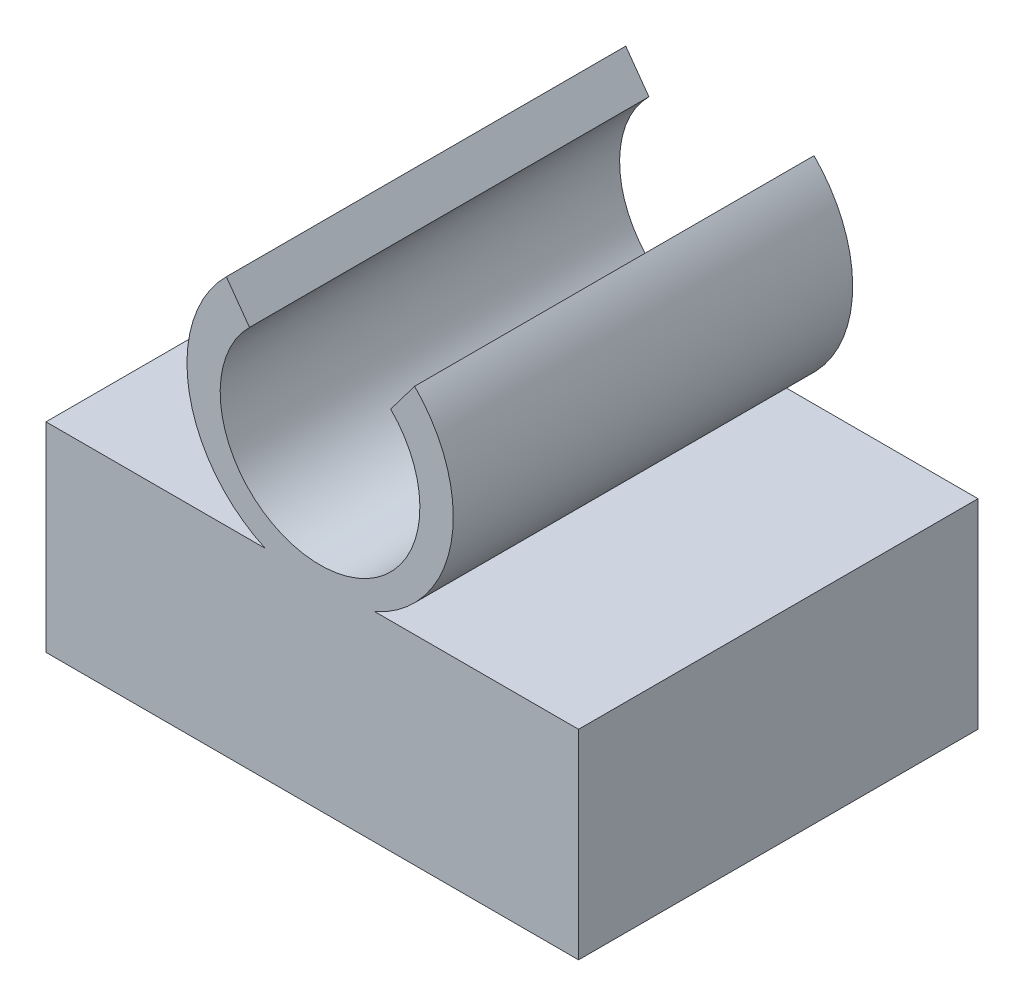
from build123d import *

# Parameters (mm, degrees)
SKETCH1_W           = 80
SKETCH1_H           = 60
BOSS_EXTRUDE2_DEPTH = 30
SKETCH2_W           = 72
SKETCH2_H           = 25
CUT_EXTRUDE1_DEPTH  = 55
BOSS_EXTRUDE3_DEPTH = 60


with BuildPart() as part:
    # Sketch1 → Boss-Extrude2 (new body)
    with BuildSketch(Plane(origin=(0, 0, 0), x_dir=(1, 0, 0), z_dir=(0, 1, 0))):
        with Locations((6.460176991, 17.057522124)):
            Rectangle(SKETCH1_W, SKETCH1_H)
    extrude(amount=BOSS_EXTRUDE2_DEPTH)

    # Sketch2 → Cut-Extrude1 (cut)
    with BuildSketch(Plane(origin=(0, 0, -47.057522124), x_dir=(-1, 0, 0), z_dir=(0, 0, -1))):
        with Locations((-6.207310929, 14.727365754)):
            Rectangle(SKETCH2_W, SKETCH2_H)
    extrude(amount=-CUT_EXTRUDE1_DEPTH, mode=Mode.SUBTRACT)


with BuildPart() as body_2:
    # Sketch3 → Boss-Extrude3 (new body)
    with BuildSketch(Plane(origin=(0, 0, -47.057522124), x_dir=(-1, 0, 0), z_dir=(0, 0, -1))):
        with BuildLine():
            Line((-18.241655929, 57.546020063), (-21.832571653, 62.312614127))
            ThreePointArc((-21.832571653, 62.312614127), (-7.559367185, 28.225064213), (6.451490845, 62.42128158))
            Line((6.451490845, 62.42128158), (2.971534297, 57.569692838))
            ThreePointArc((2.971534297, 57.569692838), (-7.606485249, 31.951270677), (-18.241655929, 57.546020063))
        make_face()
    extrude(amount=-BOSS_EXTRUDE3_DEPTH)

    # Combine1: union part
    add(part.part)


solid = body_2.part
